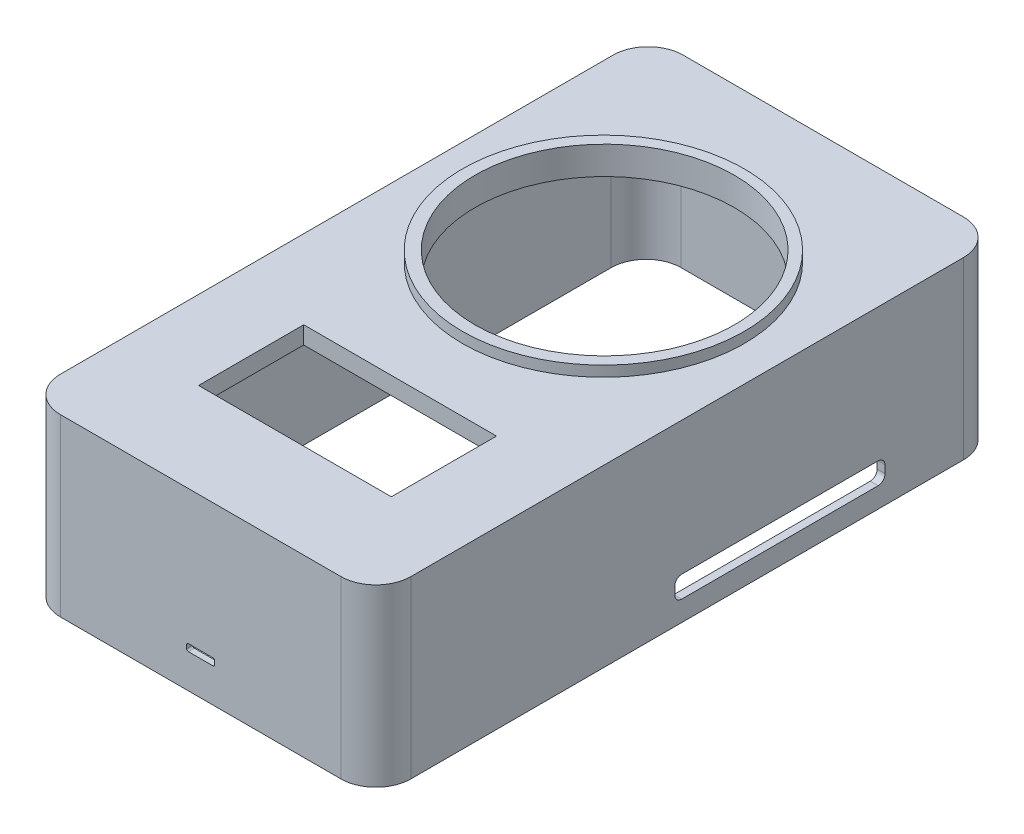
from build123d import *

# Parameters (mm, degrees)
BOSS_EXTRUDE1_DEPTH      = 25
BOSS_EXTRUDE1_DEPTH_BACK = 25
SKETCH8_R                = 37
SKETCH8_W                = 55
SKETCH8_H                = 30
CUT_EXTRUDE1_DEPTH       = 20
CUT_EXTRUDE1_DEPTH_BACK  = 35
CUT_EXTRUDE2_DEPTH       = 65
CUT_EXTRUDE4_DEPTH       = 113.525762116
SKETCH16_R               = 40.190590084
SKETCH16_R_2             = 37
BOSS_EXTRUDE3_DEPTH      = 3


with BuildPart() as part:
    # Sketch8 → Boss-Extrude1 (new, two sides: drawn at the far end of the back side and taken through both)
    with BuildSketch(Plane(origin=(0, 0, 0), x_dir=(1, 0, 0), z_dir=(0, 1, 0)).offset(-BOSS_EXTRUDE1_DEPTH_BACK)):
        with BuildLine():
            Line((-13.333333333, 97.657806344), (-40, 97.657806344))
            ThreePointArc((-40, 97.657806344), (-47.071067812, 94.728874155), (-50, 87.657806344))
            Line((-50, 87.657806344), (-50, 8.828903172))
            Line((-50, 8.828903172), (-50, -70))
            ThreePointArc((-50, -70), (-47.071067812, -77.071067812), (-40, -80))
            Line((-40, -80), (40, -80))
            ThreePointArc((40, -80), (47.071067812, -77.071067812), (50, -70))
            Line((50, -70), (50, 8.828903172))
            Line((50, 8.828903172), (50, 87.657806344))
            ThreePointArc((50, 87.657806344), (47.071067812, 94.728874155), (40, 97.657806344))
            Line((40, 97.657806344), (13.333333333, 97.657806344))
            Line((13.333333333, 97.657806344), (-13.333333333, 97.657806344))
        make_face()
        with Locations(Location((-0.034150482, 35.300694554, 0), (0, 0, 270))):
            Circle(SKETCH8_R, mode=Mode.SUBTRACT)
        with Locations((0, -38.093187293)):
            Rectangle(SKETCH8_W, SKETCH8_H, mode=Mode.SUBTRACT)
    extrude(amount=BOSS_EXTRUDE1_DEPTH + BOSS_EXTRUDE1_DEPTH_BACK)

    # Sketch14 → Cut-Extrude1 (cut, two sides: drawn at the far end of the back side and taken through both)
    with BuildSketch(Plane(origin=(0, 0, 0), x_dir=(1, 0, 0), z_dir=(0, 1, 0)).offset(-CUT_EXTRUDE1_DEPTH_BACK)):
        with BuildLine():
            Line((-37.755307684, 94.843507168), (37.755307684, 94.843507168))
            ThreePointArc((37.755307684, 94.843507168), (44.826375496, 91.91457498), (47.755307684, 84.843507168))
            Line((47.755307684, 84.843507168), (47.755307684, -68.296492832))
            ThreePointArc((47.755307684, -68.296492832), (44.826375496, -75.367560643), (37.755307684, -78.296492832))
            Line((37.755307684, -78.296492832), (-37.755307684, -78.296492832))
            ThreePointArc((-37.755307684, -78.296492832), (-44.826375496, -75.367560643), (-47.755307684, -68.296492832))
            Line((-47.755307684, -68.296492832), (-47.755307684, 84.843507168))
            ThreePointArc((-47.755307684, 84.843507168), (-44.826375496, 91.91457498), (-37.755307684, 94.843507168))
        make_face()
    extrude(amount=CUT_EXTRUDE1_DEPTH + CUT_EXTRUDE1_DEPTH_BACK, mode=Mode.SUBTRACT)

    # Sketch15 → Cut-Extrude2 (cut)
    with BuildSketch(Plane(origin=(0, 0, 0), x_dir=(0, 0, -1), z_dir=(1, 0, 0))):
        with BuildLine():
            Line((63.260342579, -13.058175161), (7.260342579, -13.058175161))
            ThreePointArc((7.260342579, -13.058175161), (5.846129016, -13.643961598), (5.260342579, -15.058175161))
            Line((5.260342579, -15.058175161), (5.260342579, -17.199912978))
            ThreePointArc((5.260342579, -17.199912978), (5.846129016, -18.61412654), (7.260342579, -19.199912978))
            Line((7.260342579, -19.199912978), (63.260342579, -19.199912978))
            ThreePointArc((63.260342579, -19.199912978), (64.674556141, -18.61412654), (65.260342579, -17.199912978))
            Line((65.260342579, -17.199912978), (65.260342579, -15.058175161))
            ThreePointArc((65.260342579, -15.058175161), (64.674556141, -13.643961598), (63.260342579, -13.058175161))
        make_face()
    extrude(amount=CUT_EXTRUDE2_DEPTH, mode=Mode.SUBTRACT)

    # Sketch9 → Cut-Extrude4 (cut, through all)
    with BuildSketch(Plane.XY):
        with BuildLine():
            Line((3.499295318, -13.313051471), (-3.500704682, -13.313051471))
            ThreePointArc((-3.500704682, -13.313051471), (-3.854258072, -13.45949808), (-4.000704682, -13.813051471))
            Line((-4.000704682, -13.813051471), (-4.000704682, -14.813051471))
            ThreePointArc((-4.000704682, -14.813051471), (-3.854258072, -15.166604861), (-3.500704682, -15.313051471))
            Line((-3.500704682, -15.313051471), (3.499295318, -15.313051471))
            ThreePointArc((3.499295318, -15.313051471), (3.852848709, -15.166604861), (3.999295318, -14.813051471))
            Line((3.999295318, -14.813051471), (3.999295318, -13.813051471))
            ThreePointArc((3.999295318, -13.813051471), (3.852848709, -13.45949808), (3.499295318, -13.313051471))
        make_face()
    extrude(amount=CUT_EXTRUDE4_DEPTH, mode=Mode.SUBTRACT)

    # Sketch16 → Boss-Extrude3 (add)
    with BuildSketch(Plane(origin=(0, 25, 0), x_dir=(1, 0, 0), z_dir=(0, 1, 0))):
        with Locations(Location((-0.197566829, 35.094491393, 0), (0, 0, 270))):
            Circle(SKETCH16_R)
        with Locations(Location((-0.034150482, 35.300694554, 0), (0, 0, 270))):
            Circle(SKETCH16_R_2, mode=Mode.SUBTRACT)
    extrude(amount=BOSS_EXTRUDE3_DEPTH)


solid = part.part
